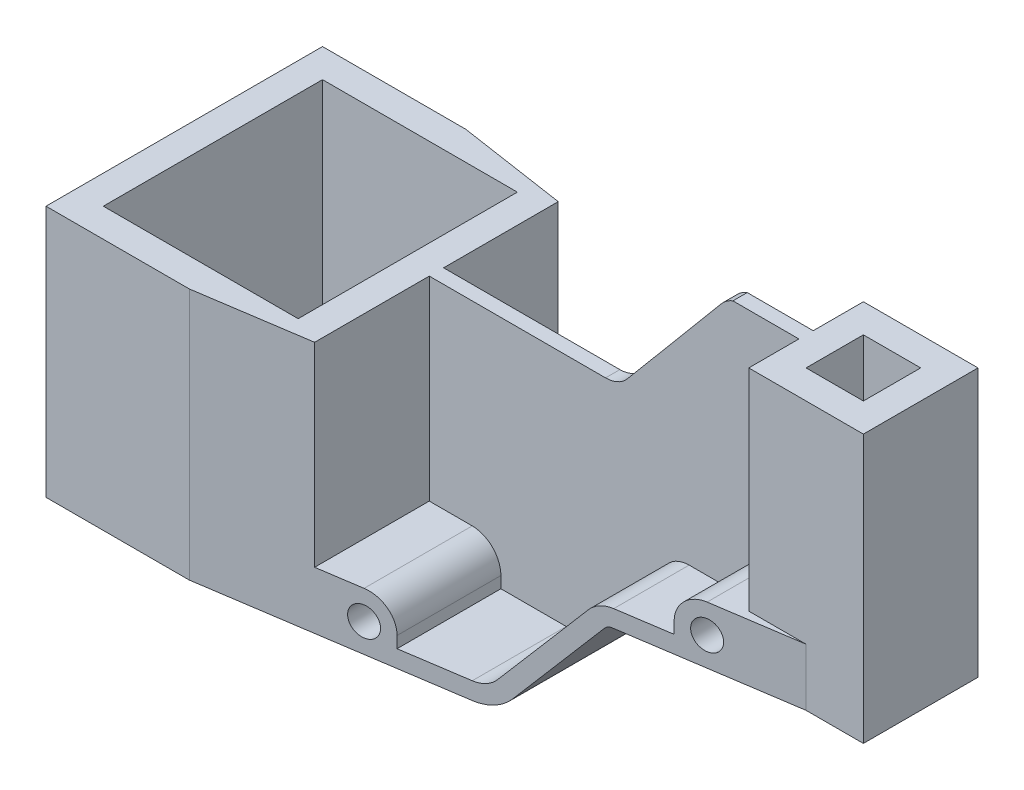
from build123d import *

# Parameters (mm, degrees)
BOSS_EXTRU_3_DEPTH       = 88
ESQUISSE4_W              = 68
ESQUISSE4_H              = 76.5
ENL_V_MAT_EXTRU_1_DEPTH  = 236.459258684
ENL_V_MAT_EXTRU_2_DEPTH  = 68
ENL_V_MAT_EXTRU_5_REACH  = 245.615
ESQUISSE6_W              = 150.690647389
ESQUISSE6_H              = 20
BOSS_EXTRU_5_DEPTH       = 20
ESQUISSE14_W             = 40
ESQUISSE14_H             = 40
ENL_V_MAT_EXTRU_6_DEPTH  = 236.459258684
BOSS_EXTRU_8_DEPTH       = 40
ENL_V_MAT_EXTRU_7_DEPTH  = 236.984242059
ESQUISSE27_W             = 169
ESQUISSE27_H             = 5
BOSS_EXTRU_9_DEPTH       = 45.5
BOSS_EXTRU_10_REACH      = 258.45
ESQUISSE28_R             = 5
ENL_V_MAT_EXTRU_9_DEPTH  = 45.5
BOSS_EXTRU_12_DEPTH      = 17.5
ENL_V_MAT_EXTRU_10_REACH = 248.129
BOSS_EXTRU_13_REACH      = 258.45
ESQUISSE34_R             = 5
BOSS_EXTRU_14_DEPTH      = 17.5
ESQUISSE36_W             = 20
ESQUISSE36_H             = 20
ENL_V_MAT_EXTRU_11_DEPTH = 256.967405152
ESQUISSE37_R             = 5
ENL_V_MAT_EXTRU_12_DEPTH = 10
ESQUISSE38_R             = 5
ENL_V_MAT_EXTRU_13_DEPTH = 10


with BuildPart() as part:
    # Esquisse1 → Boss.-Extru.3 (new body)
    with BuildSketch(Plane(origin=(0, 0, 0), x_dir=(1, 0, 0), z_dir=(0, 1, 0))):
        Polygon((193, 20), (6, 48.25), (-44, 48.25), (-44, -48.25), (6, -48.25), (193, -20), (213, -20), (213, 20), align=None)
    extrude(amount=BOSS_EXTRU_3_DEPTH)

    # Esquisse4 → Enlèv. mat.-Extru.1 (cut, through all)
    with BuildSketch(Plane(origin=(0, 88, 0), x_dir=(1, 0, 0), z_dir=(0, 1, 0))):
        Rectangle(ESQUISSE4_W, ESQUISSE4_H)
    extrude(amount=-ENL_V_MAT_EXTRU_1_DEPTH, mode=Mode.SUBTRACT)

    # Esquisse5 → Enlèv. mat.-Extru.2 (cut)
    with BuildSketch(Plane(origin=(0, 88, 0), x_dir=(1, 0, 0), z_dir=(0, 1, 0))):
        Polygon((193, 20), (173, 20), (173, 2.5), (44, 2.5), (44, 42.509358289), align=None)
        Polygon((173, -20), (193, -20), (44, -42.509358289), (44, -2.5), (173, -2.5), align=None)
    extrude(amount=-ENL_V_MAT_EXTRU_2_DEPTH, mode=Mode.SUBTRACT)

    # Enlèv. mat.-Extru.5: up to this plane
    enl_v_mat_extru_5_end = Plane(origin=(173, 20, 2.5), z_dir=(0, 0, -1))
    # Esquisse6 → Enlèv. mat.-Extru.5 (cut, up to the surface)
    with BuildSketch(Plane(origin=(7.260340781, 0, 48.059600925), x_dir=(0.9887806747234926, 0, -0.14937462064673088), z_dir=(0.14937462064673088, 0, 0.9887806747234927)), mode=Mode.PRIVATE) as enl_v_mat_extru_5_sk1:
        with Locations((112.501854115, 10)):
            Rectangle(ESQUISSE6_W, ESQUISSE6_H)
    enl_v_mat_extru_5_tool1 = split(extrude(enl_v_mat_extru_5_sk1.sketch, amount=-ENL_V_MAT_EXTRU_5_REACH, mode=Mode.PRIVATE), bisect_by=enl_v_mat_extru_5_end, keep=Keep.BOTH, mode=Mode.PRIVATE)
    add(enl_v_mat_extru_5_tool1.solids().sort_by_distance((118.5, 10, 31.254679))[0], mode=Mode.SUBTRACT)

    # Esquisse11 → Boss.-Extru.5 (add)
    with BuildSketch(Plane.XZ.offset(-20)):
        Polygon((37.955805499, 2.5), (44, 2.5), (44, 42.509358289), align=None)
    extrude(amount=BOSS_EXTRU_5_DEPTH)

    # Esquisse14 → Enlèv. mat.-Extru.6 (cut, through all)
    with BuildSketch(Plane(origin=(0, 88, 0), x_dir=(1, 0, 0), z_dir=(0, 1, 0))):
        with Locations((193, 0)):
            Rectangle(ESQUISSE14_W, ESQUISSE14_H)
    extrude(amount=-ENL_V_MAT_EXTRU_6_DEPTH, mode=Mode.SUBTRACT)

    # Esquisse22 → Boss.-Extru.8 (add)
    with BuildSketch(Plane(origin=(173, 0, 0), x_dir=(0, 0, -1), z_dir=(1, 0, 0))):
        Polygon((-2.5, 0), (20, 0), (20, 20), (2.5, 20), (2.5, 88), (-2.5, 88), align=None)
    extrude(amount=BOSS_EXTRU_8_DEPTH)

    # Esquisse23 → Enlèv. mat.-Extru.7 (cut, through all)
    with BuildSketch(Plane.XY.offset(2.5)):
        with BuildLine():
            Line((213, 0), (213, 40))
            Line((213, 40), (193, 40))
            Line((193, 40), (159, 40))
            Line((159, 40), (134.690473047, 40))
            ThreePointArc((134.690473047, 40), (133, 39.625231148), (131.626295274, 38.571150439))
            Line((131.626295274, 38.571150439), (104.057045727, 5.715398245))
            ThreePointArc((104.057045727, 5.715398245), (98.562226825, 1.499075407), (91.800334637, 0))
            Line((91.800334637, 0), (213, 0))
        make_face()
    extrude(amount=-ENL_V_MAT_EXTRU_7_DEPTH, mode=Mode.SUBTRACT)

    # Esquisse27 → Boss.-Extru.9 (add)
    with BuildSketch(Plane(origin=(0, 88, 0), x_dir=(1, 0, 0), z_dir=(0, 1, 0))):
        with Locations((128.5, 0)):
            Rectangle(ESQUISSE27_W, ESQUISSE27_H)
    extrude(amount=BOSS_EXTRU_9_DEPTH)

    # Boss.-Extru.10: up to this plane
    boss_extru_10_end = Plane(origin=(7.260340781, 88, 48.059600925), z_dir=(-0.14937462064673085, 0, -0.9887806747234926))
    # Esquisse28 → Boss.-Extru.10 (add, up to the surface)
    with BuildSketch(Plane.XY.offset(2.5), mode=Mode.PRIVATE) as boss_extru_10_sk1:
        with BuildLine():
            Line((132.074257782, 39.025792076), (132.14881397, 39.114644681))
            ThreePointArc((132.14881397, 39.114644681), (133, 39.767782693), (134.047464579, 40))
            Line((134.047464579, 40), (134.690473047, 40))
            Line((134.690473047, 40), (159, 40))
            Line((159, 40), (193, 40))
            Line((193, 40), (193, 60))
            Line((193, 60), (173, 60))
            Line((173, 60), (163, 60))
            ThreePointArc((163, 60), (155.928932188, 57.071067812), (153, 50))
            Line((153, 50), (153, 46))
            Line((153, 46), (134.690473047, 46))
            ThreePointArc((134.690473047, 46), (130.46429043, 45.06307787), (127.030028616, 42.427876097))
            Line((127.030028616, 42.427876097), (99.460779068, 9.572123903))
            ThreePointArc((99.460779068, 9.572123903), (96.026517254, 6.93692213), (91.800334637, 6))
            Line((91.800334637, 6), (69, 6))
            Line((69, 6), (69, 10))
            ThreePointArc((69, 10), (66.071067812, 17.071067812), (59, 20))
            Line((59, 20), (44, 20))
            Line((44, 20), (44, 0))
            Line((44, 0), (63, 0))
            Line((63, 0), (91.800334637, 0))
            ThreePointArc((91.800334637, 0), (98.562226825, 1.499075407), (104.057045727, 5.715398245))
            Line((104.057045727, 5.715398245), (131.626295274, 38.571150439))
            ThreePointArc((131.626295274, 38.571150439), (131.841194012, 38.807420343), (132.074257782, 39.025792076))
        make_face()
        with Locations((59, 10)):
            Circle(ESQUISSE28_R, mode=Mode.SUBTRACT)
        with Locations((163, 50)):
            Circle(ESQUISSE28_R, mode=Mode.SUBTRACT)
    boss_extru_10_tool1 = split(extrude(boss_extru_10_sk1.sketch, amount=BOSS_EXTRU_10_REACH, mode=Mode.PRIVATE), bisect_by=boss_extru_10_end, keep=Keep.BOTH, mode=Mode.PRIVATE)
    add(boss_extru_10_tool1.solids().sort_by_distance((124.318782, 30.344637, 2.5))[0])

    # Esquisse29 → Enlèv. mat.-Extru.9 (cut)
    with BuildSketch(Plane.XY.offset(2.5)):
        with BuildLine():
            ThreePointArc((145.939599002, 130.613536933), (147.768845256, 132.309522469), (149.96093833, 133.5))
            Line((149.96093833, 133.5), (44, 133.5))
            Line((44, 133.5), (44, 88))
            Line((44, 88), (105.519519296, 88))
            ThreePointArc((105.519519296, 88), (109.745701914, 88.93692213), (113.179963727, 91.572123903))
            Line((113.179963727, 91.572123903), (145.939599002, 130.613536933))
        make_face()
    extrude(amount=-ENL_V_MAT_EXTRU_9_DEPTH, mode=Mode.SUBTRACT)

    # Esquisse31 → Boss.-Extru.12 (add)
    with BuildSketch(Plane.XY.offset(2.5)):
        Polygon((213, 133.5), (173, 133.5), (173, 60), (193, 60), (193, 40), (213, 40), align=None)
    extrude(amount=BOSS_EXTRU_12_DEPTH)

    # Esquisse33 → Enlèv. mat.-Extru.10 (cut, up to next)
    with BuildSketch(Plane(origin=(0, 20, 0), x_dir=(1, 0, 0), z_dir=(0, 1, 0)), mode=Mode.PRIVATE) as enl_v_mat_extru_10_sk1:
        Polygon((44, 42.509358289), (44, 2.5), (116.043249791, 2.5), (116.043249791, 31.625819216), align=None)
    enl_v_mat_extru_10_tool1 = extrude(enl_v_mat_extru_10_sk1.sketch, amount=-ENL_V_MAT_EXTRU_10_REACH, mode=Mode.PRIVATE) & part.part
    add(enl_v_mat_extru_10_tool1.solids().sort_by_distance((78.131402, 20, -19.926572))[0], mode=Mode.SUBTRACT)

    # Boss.-Extru.13: up to this plane
    boss_extru_13_end = Plane(origin=(7.260340781, 88, -48.059600925), z_dir=(0.14937462064673085, 0, -0.9887806747234926))
    # Esquisse34 → Boss.-Extru.13 (add, up to the surface)
    with BuildSketch(Plane(origin=(0, 0, -2.5), x_dir=(-1, 0, 0), z_dir=(0, 0, -1)), mode=Mode.PRIVATE) as boss_extru_13_sk1:
        with BuildLine():
            Line((-44, 0), (-44, 20))
            Line((-44, 20), (-59, 20))
            ThreePointArc((-59, 20), (-66.071067812, 17.071067812), (-69, 10))
            Line((-69, 10), (-69, 6))
            Line((-69, 6), (-91.800334637, 6))
            ThreePointArc((-91.800334637, 6), (-96.026517254, 6.93692213), (-99.460779068, 9.572123903))
            Line((-99.460779068, 9.572123903), (-127.030028616, 42.427876097))
            ThreePointArc((-127.030028616, 42.427876097), (-130.46429043, 45.06307787), (-134.690473047, 46))
            Line((-134.690473047, 46), (-153, 46))
            Line((-153, 46), (-153, 50))
            ThreePointArc((-153, 50), (-155.928932188, 57.071067812), (-163, 60))
            Line((-163, 60), (-173, 60))
            Line((-173, 60), (-193, 60))
            Line((-193, 60), (-193, 40))
            Line((-193, 40), (-159, 40))
            Line((-159, 40), (-134.690473047, 40))
            Line((-134.690473047, 40), (-134.047464579, 40))
            ThreePointArc((-134.047464579, 40), (-133, 39.767782693), (-132.14881397, 39.114644681))
            Line((-132.14881397, 39.114644681), (-132.074257782, 39.025792076))
            ThreePointArc((-132.074257782, 39.025792076), (-131.841194012, 38.807420343), (-131.626295274, 38.571150439))
            Line((-131.626295274, 38.571150439), (-104.057045727, 5.715398245))
            ThreePointArc((-104.057045727, 5.715398245), (-98.562226825, 1.499075407), (-91.800334637, 0))
            Line((-91.800334637, 0), (-63, 0))
            Line((-63, 0), (-44, 0))
        make_face()
        with Locations(Location((-163, 50, 0), (0, 0, 180))):
            Circle(ESQUISSE34_R, mode=Mode.SUBTRACT)
        with Locations(Location((-59, 10, 0), (0, 0, 180))):
            Circle(ESQUISSE34_R, mode=Mode.SUBTRACT)
    boss_extru_13_tool1 = split(extrude(boss_extru_13_sk1.sketch, amount=BOSS_EXTRU_13_REACH, mode=Mode.PRIVATE), bisect_by=boss_extru_13_end, keep=Keep.BOTH, mode=Mode.PRIVATE)
    add(boss_extru_13_tool1.solids().sort_by_distance((124.318782, 30.344637, -2.5))[0])

    # Esquisse35 → Boss.-Extru.14 (add)
    with BuildSketch(Plane(origin=(0, 0, -2.5), x_dir=(-1, 0, 0), z_dir=(0, 0, -1))):
        Polygon((-173, 60), (-173, 133.5), (-213, 133.5), (-213, 40), (-193, 40), (-193, 60), align=None)
    extrude(amount=BOSS_EXTRU_14_DEPTH)

    # Esquisse36 → Enlèv. mat.-Extru.11 (cut, through all)
    with BuildSketch(Plane(origin=(0, 133.5, 0), x_dir=(1, 0, 0), z_dir=(0, 1, 0))):
        with Locations((193, 0)):
            Rectangle(ESQUISSE36_W, ESQUISSE36_H)
    extrude(amount=-ENL_V_MAT_EXTRU_11_DEPTH, mode=Mode.SUBTRACT)

    # Esquisse37 → Enlèv. mat.-Extru.12 (cut)
    with BuildSketch(Plane.XY.offset(2.5)):
        with Locations((59, 10)):
            Circle(ESQUISSE37_R)
    extrude(amount=-ENL_V_MAT_EXTRU_12_DEPTH, mode=Mode.SUBTRACT)

    # Esquisse38 → Enlèv. mat.-Extru.13 (cut)
    with BuildSketch(Plane.XY.offset(2.5)):
        with Locations((163, 50)):
            Circle(ESQUISSE38_R)
    extrude(amount=-ENL_V_MAT_EXTRU_13_DEPTH, mode=Mode.SUBTRACT)


solid = part.part
